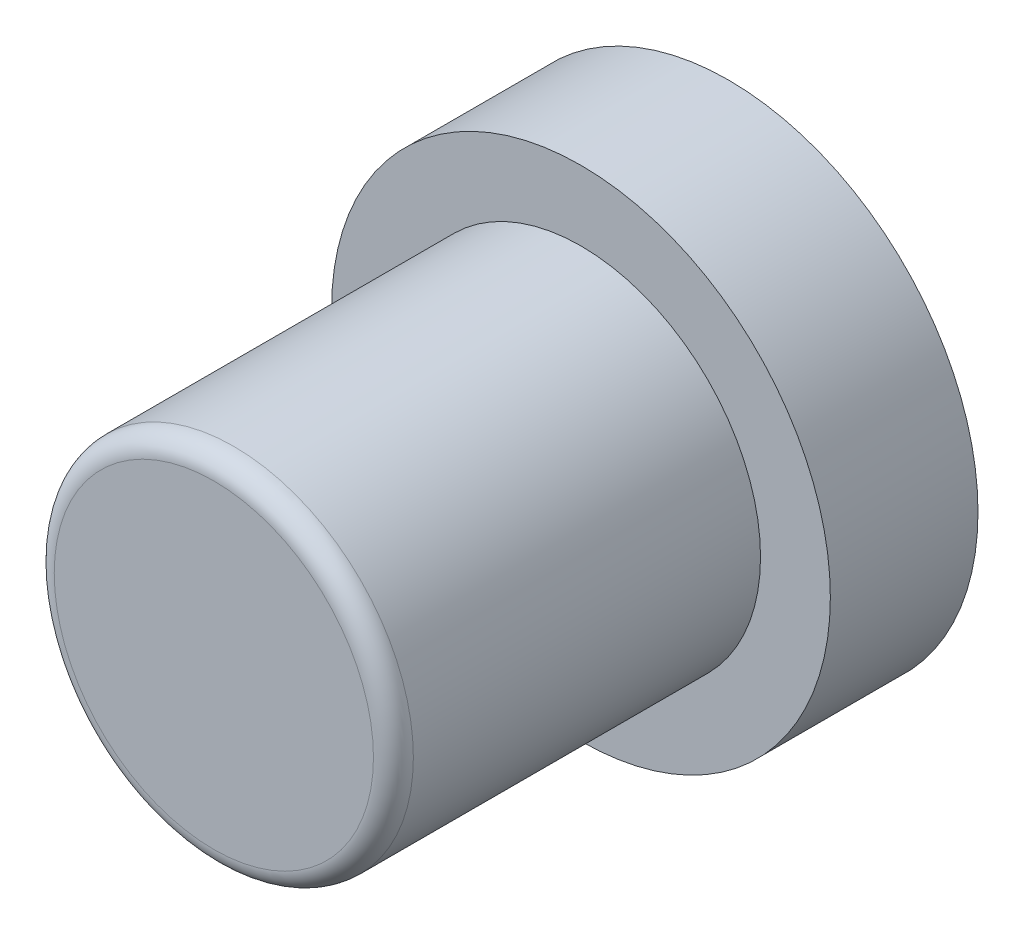
from build123d import *

# Parameters (mm, degrees)
SKETCH1_R           = 6.25
BOSS_EXTRUDE1_DEPTH = 3.7
SKETCH2_R           = 4.5
BOSS_EXTRUDE2_DEPTH = 9.2
FILLET1_R           = 0.5


with BuildPart() as part:
    # Sketch1 → Boss-Extrude1 (new body)
    with BuildSketch(Plane.XY):
        Circle(SKETCH1_R)
    extrude(amount=BOSS_EXTRUDE1_DEPTH)

    # Sketch2 → Boss-Extrude2 (add)
    with BuildSketch(Plane.XY.offset(3.7)):
        Circle(SKETCH2_R)
    extrude(amount=BOSS_EXTRUDE2_DEPTH)

    # Fillet1
    fillet1_edges = [part.edges().sort_by_distance(p)[0] for p in [
        (-4.5, 0, 12.9),
    ]]
    fillet(fillet1_edges, radius=FILLET1_R)


solid = part.part
